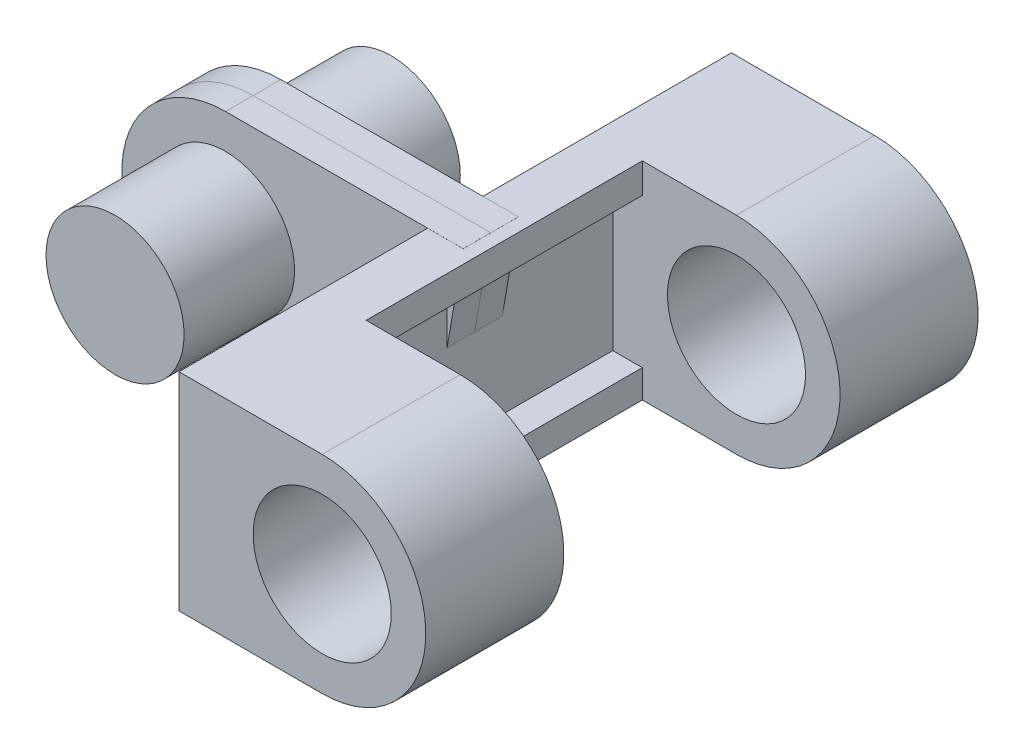
from build123d import *

# Parameters (mm, degrees)
SKETCH1_R           = 0.5
BOSS_EXTRUDE1_DEPTH = 1
BOSS_EXTRUDE2_DEPTH = 1
BOSS_EXTRUDE4_DEPTH = 0.2
SKETCH5_R           = 0.5
BOSS_EXTRUDE5_DEPTH = 1


with BuildPart() as part:
    # Sketch1 → Boss-Extrude1 (new body)
    with BuildSketch(Plane.XY):
        with BuildLine():
            Line((-1.036772363, 0.75), (0, 0.75))
            ThreePointArc((0, 0.75), (0.75, 0), (0, -0.75))
            Line((0, -0.75), (-1.036772363, -0.75))
            Line((-1.036772363, -0.75), (-1.036772363, 0.75))
        make_face()
        Circle(SKETCH1_R, mode=Mode.SUBTRACT)
    extrude(amount=BOSS_EXTRUDE1_DEPTH)

    # Sketch2 → Boss-Extrude2 (add)
    with BuildSketch(Plane.XY.offset(1)):
        Polygon((-0.681856946, 0.75), (-1.036772363, 0.75), (-1.036772363, -0.75), (-0.681856946, -0.75), (-0.681856946, -0.546810509), (-0.895709018, -0.546810509), (-0.895709018, 0.533549045), (-0.681856946, 0.533549045), align=None)
    extrude(amount=BOSS_EXTRUDE2_DEPTH)

    # Mirror4: part across plane


with BuildPart() as part_1:
    add(part.part)
    add(part.part.mirror(Plane.XY.offset(2)))


with BuildPart() as body_2:
    # Sketch4 → Boss-Extrude4 (new body)
    with BuildSketch(Plane.XY.offset(2)):
        with BuildLine():
            Line((-0.778702826, 0.750312574), (-2.499930103, 0.750472884))
            ThreePointArc((-2.499930103, 0.750472884), (-3.250472883, -8.6331e-05), (-2.499757441, -0.750472849))
            Line((-2.499757441, -0.750472849), (-1.036772363, -0.75))
            Line((-1.036772363, -0.75), (-0.778702826, 0.750312574))
        make_face()
    extrude(amount=BOSS_EXTRUDE4_DEPTH)

    # Sketch5 → Boss-Extrude5 (add)
    with BuildSketch(Plane(origin=(0, 0, 2), x_dir=(-1, 0, 0), z_dir=(0, 0, -1))):
        with Locations((2.5, 0)):
            Circle(SKETCH5_R)
    extrude(amount=BOSS_EXTRUDE5_DEPTH)


with BuildPart() as body_3:
    # Mirror5: mirrored copy
    add(body_2.part.mirror(Plane.XY.offset(2)))


solid = Compound([part_1.part, body_2.part, body_3.part])
